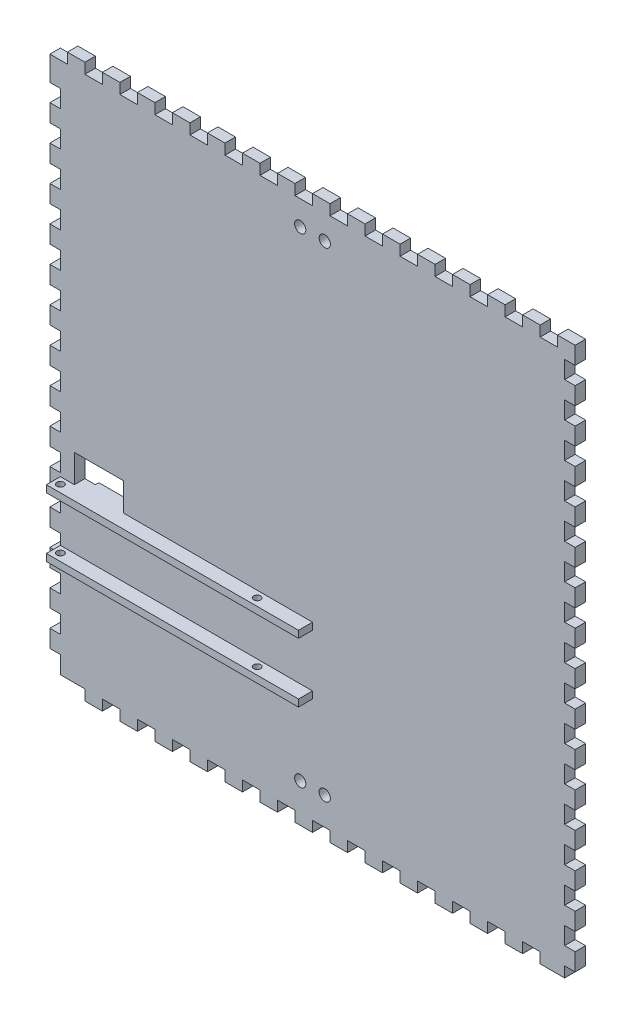
from build123d import *

# Parameters (mm, degrees)
SKETCH1_W            = 150
SKETCH1_H            = 158
BOSS_EXTRUDE1_DEPTH  = 5
SKETCH2_W            = 150
SKETCH2_H            = 158
SKETCH2_W_2          = 130
SKETCH2_H_2          = 130
CUT_EXTRUDE1_DEPTH   = 2
SKETCH3_W            = 10
SKETCH3_H            = 13.1
CUT_EXTRUDE2_DEPTH   = 1
LPATTERN1_COUNT      = 7
LPATTERN1_PITCH      = 20
LPATTERN1_COUNT_DIR2 = 5
LPATTERN1_PITCH_DIR2 = 26
SKETCH4_W            = 10
SKETCH4_H            = 13.1
CUT_EXTRUDE3_DEPTH   = 1
LPATTERN2_COUNT      = 6
LPATTERN2_PITCH      = 20
LPATTERN2_COUNT_DIR2 = 5
LPATTERN2_PITCH_DIR2 = 26
SKETCH5_W            = 5
SKETCH5_H            = 3
CUT_EXTRUDE4_DEPTH   = 109.972473589
LPATTERN3_COUNT      = 15
LPATTERN3_PITCH      = 10
SKETCH6_W            = 3
SKETCH6_H            = 5
CUT_EXTRUDE5_DEPTH   = 109.972473589
LPATTERN4_COUNT      = 16
LPATTERN4_PITCH      = 10
SKETCH7_W            = 3
SKETCH7_H            = 5
CUT_EXTRUDE6_DEPTH   = 109.972473589
LPATTERN5_COUNT      = 15
LPATTERN5_PITCH      = 10
SKETCH8_W            = 5
SKETCH8_H            = 3
CUT_EXTRUDE7_DEPTH   = 109.972473589
LPATTERN6_COUNT      = 14
LPATTERN6_PITCH      = 10
SKETCH9_W            = 5
SKETCH9_H            = 3
CUT_EXTRUDE8_DEPTH   = 3
SKETCH10_R           = 1.6
CUT_EXTRUDE9_DEPTH   = 10
SKETCH11_R           = 1.6
CUT_EXTRUDE10_DEPTH  = 10
SKETCH12_W           = 4
SKETCH12_H           = 2
BOSS_EXTRUDE2_DEPTH  = 72
SKETCH13_R           = 1
CUT_EXTRUDE11_DEPTH  = 10
SKETCH14_W           = 4
SKETCH14_H           = 2
BOSS_EXTRUDE3_DEPTH  = 72
SKETCH15_R           = 1
CUT_EXTRUDE12_DEPTH  = 131.161438222
SKETCH16_W           = 14
SKETCH16_H           = 8
CUT_EXTRUDE13_DEPTH  = 110.045861911


with BuildPart() as part:
    # Sketch1 → Boss-Extrude1 (new body)
    with BuildSketch(Plane.XY):
        Rectangle(SKETCH1_W, SKETCH1_H)
    extrude(amount=BOSS_EXTRUDE1_DEPTH)

    # Sketch2 → Cut-Extrude1 (cut)
    with BuildSketch(Plane(origin=(0, 0, 0), x_dir=(-1, 0, 0), z_dir=(0, 0, -1))):
        Rectangle(SKETCH2_W, SKETCH2_H)
        Rectangle(SKETCH2_W_2, SKETCH2_H_2, mode=Mode.SUBTRACT)
    extrude(amount=-CUT_EXTRUDE1_DEPTH, mode=Mode.SUBTRACT)

    # Sketch3 → Cut-Extrude2 (cut)
    with BuildSketch(Plane(origin=(0, 0, 0), x_dir=(-1, 0, 0), z_dir=(0, 0, -1))):
        with Locations((-60, 45.4)):
            Rectangle(SKETCH3_W, SKETCH3_H)
    cut_extrude2 = extrude(amount=-CUT_EXTRUDE2_DEPTH, mode=Mode.SUBTRACT)

    # LPattern1: Cut-Extrude2 7 × 5
    with Locations(*[(-i * LPATTERN1_PITCH, -j * LPATTERN1_PITCH_DIR2, 0) for i in range(LPATTERN1_COUNT) for j in range(LPATTERN1_COUNT_DIR2) if (i, j) != (0, 0)]):
        add(cut_extrude2, mode=Mode.SUBTRACT)

    # Sketch4 → Cut-Extrude3 (cut)
    with BuildSketch(Plane(origin=(0, 0, 0), x_dir=(-1, 0, 0), z_dir=(0, 0, -1))):
        with Locations((-50, 58.45)):
            Rectangle(SKETCH4_W, SKETCH4_H)
    cut_extrude3 = extrude(amount=-CUT_EXTRUDE3_DEPTH, mode=Mode.SUBTRACT)

    # LPattern2: Cut-Extrude3 6 × 5
    with Locations(*[(-i * LPATTERN2_PITCH, -j * LPATTERN2_PITCH_DIR2, 0) for i in range(LPATTERN2_COUNT) for j in range(LPATTERN2_COUNT_DIR2) if (i, j) != (0, 0)]):
        add(cut_extrude3, mode=Mode.SUBTRACT)

    # Sketch5 → Cut-Extrude4 (cut, through all)
    with BuildSketch(Plane(origin=(0, 0, 2), x_dir=(-1, 0, 0), z_dir=(0, 0, -1))):
        with Locations((-67.5, 77.5)):
            Rectangle(SKETCH5_W, SKETCH5_H)
    cut_extrude4 = extrude(amount=-CUT_EXTRUDE4_DEPTH, mode=Mode.SUBTRACT)

    # LPattern3: Cut-Extrude4 ×15
    with Locations(*[(-i * LPATTERN3_PITCH, 0, 0) for i in range(1, LPATTERN3_COUNT)]):
        add(cut_extrude4, mode=Mode.SUBTRACT)

    # Sketch6 → Cut-Extrude5 (cut, through all)
    with BuildSketch(Plane(origin=(0, 0, 2), x_dir=(-1, 0, 0), z_dir=(0, 0, -1))):
        with Locations((-73.5, 71.5)):
            Rectangle(SKETCH6_W, SKETCH6_H)
    cut_extrude5 = extrude(amount=-CUT_EXTRUDE5_DEPTH, mode=Mode.SUBTRACT)

    # LPattern4: Cut-Extrude5 ×16
    with Locations(*[(0, -i * LPATTERN4_PITCH, 0) for i in range(1, LPATTERN4_COUNT)]):
        add(cut_extrude5, mode=Mode.SUBTRACT)

    # Sketch7 → Cut-Extrude6 (cut, through all)
    with BuildSketch(Plane(origin=(0, 0, 2), x_dir=(-1, 0, 0), z_dir=(0, 0, -1))):
        with Locations((73.5, 66.5)):
            Rectangle(SKETCH7_W, SKETCH7_H)
    cut_extrude6 = extrude(amount=-CUT_EXTRUDE6_DEPTH, mode=Mode.SUBTRACT)

    # LPattern5: Cut-Extrude6 ×15
    with Locations(*[(0, -i * LPATTERN5_PITCH, 0) for i in range(1, LPATTERN5_COUNT)]):
        add(cut_extrude6, mode=Mode.SUBTRACT)

    # Sketch8 → Cut-Extrude7 (cut, through all)
    with BuildSketch(Plane(origin=(0, 0, 2), x_dir=(-1, 0, 0), z_dir=(0, 0, -1))):
        with Locations((-62.5, -77.5)):
            Rectangle(SKETCH8_W, SKETCH8_H)
    cut_extrude7 = extrude(amount=-CUT_EXTRUDE7_DEPTH, mode=Mode.SUBTRACT)

    # LPattern6: Cut-Extrude7 ×14
    with Locations(*[(-i * LPATTERN6_PITCH, 0, 0) for i in range(1, LPATTERN6_COUNT)]):
        add(cut_extrude7, mode=Mode.SUBTRACT)

    # Sketch9 → Cut-Extrude8 (cut)
    with BuildSketch(Plane(origin=(0, 0, 2), x_dir=(-1, 0, 0), z_dir=(0, 0, -1))):
        with Locations((72.5, -77.5)):
            Rectangle(SKETCH9_W, SKETCH9_H)
    extrude(amount=-CUT_EXTRUDE8_DEPTH, mode=Mode.SUBTRACT)

    # Sketch10 → Cut-Extrude9 (cut)
    with BuildSketch(Plane(origin=(0, 0, 2), x_dir=(-1, 0, 0), z_dir=(0, 0, -1))):
        with Locations((3.5, 69)):
            Circle(SKETCH10_R)
        with Locations((-3.5, 69)):
            Circle(SKETCH10_R)
    extrude(amount=-CUT_EXTRUDE9_DEPTH, mode=Mode.SUBTRACT)

    # Sketch11 → Cut-Extrude10 (cut)
    with BuildSketch(Plane(origin=(0, 0, 2), x_dir=(-1, 0, 0), z_dir=(0, 0, -1))):
        with Locations((3.5, -68)):
            Circle(SKETCH11_R)
        with Locations((-3.5, -68)):
            Circle(SKETCH11_R)
    extrude(amount=-CUT_EXTRUDE10_DEPTH, mode=Mode.SUBTRACT)

    # Sketch12 → Boss-Extrude2 (add)
    with BuildSketch(Plane(origin=(0, 0, 0), x_dir=(0, 0, -1), z_dir=(1, 0, 0))):
        with Locations((-7, -45)):
            Rectangle(SKETCH12_W, SKETCH12_H)
    extrude(amount=-BOSS_EXTRUDE2_DEPTH)

    # Sketch13 → Cut-Extrude11 (cut)
    with BuildSketch(Plane(origin=(0, -44, 0), x_dir=(1, 0, 0), z_dir=(0, 1, 0))):
        with Locations(Location((-70.1, -6.9, 0), (0, 0, 270))):
            Circle(SKETCH13_R)
        with Locations(Location((-13.9, -6.9, 0), (0, 0, 270))):
            Circle(SKETCH13_R)
    extrude(amount=-CUT_EXTRUDE11_DEPTH, mode=Mode.SUBTRACT)

    # Sketch14 → Boss-Extrude3 (add)
    with BuildSketch(Plane(origin=(0, 0, 0), x_dir=(0, 0, -1), z_dir=(1, 0, 0))):
        with Locations((-7, -28)):
            Rectangle(SKETCH14_W, SKETCH14_H)
    extrude(amount=-BOSS_EXTRUDE3_DEPTH)

    # Sketch15 → Cut-Extrude12 (cut, through all)
    with BuildSketch(Plane(origin=(0, -27, 0), x_dir=(1, 0, 0), z_dir=(0, 1, 0))):
        with Locations(Location((-70.1, -6.9, 0), (0, 0, 270))):
            Circle(SKETCH15_R)
        with Locations(Location((-13.9, -6.9, 0), (0, 0, 270))):
            Circle(SKETCH15_R)
    extrude(amount=-CUT_EXTRUDE12_DEPTH, mode=Mode.SUBTRACT)

    # Sketch16 → Cut-Extrude13 (cut, through all)
    with BuildSketch(Plane.XY.offset(5)):
        with Locations((-61, -23)):
            Rectangle(SKETCH16_W, SKETCH16_H)
    extrude(amount=-CUT_EXTRUDE13_DEPTH, mode=Mode.SUBTRACT)


solid = part.part
